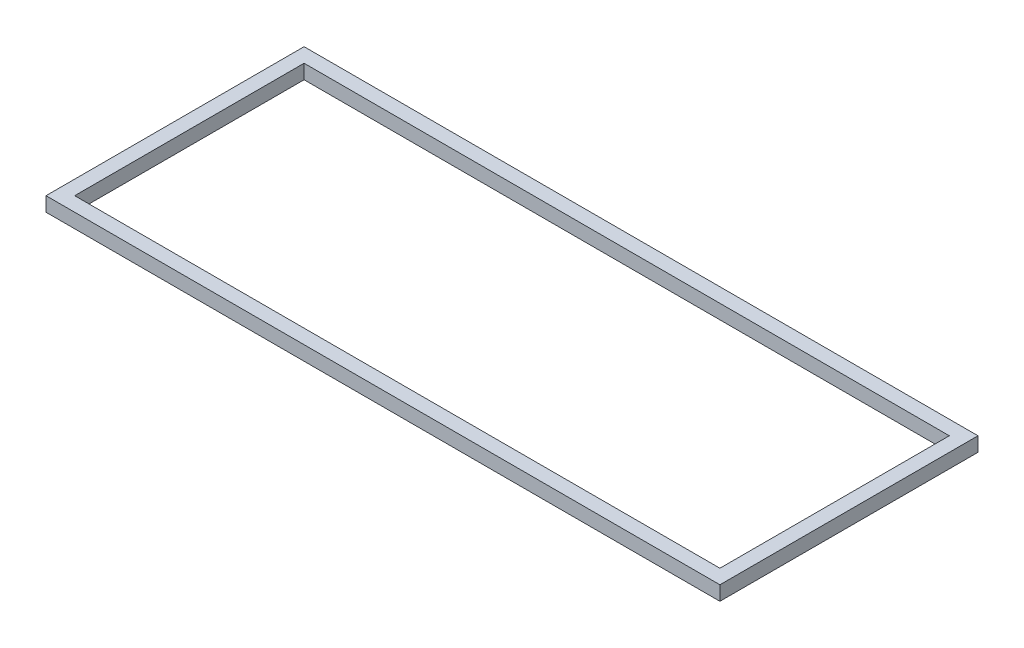
from build123d import *

# Parameters (mm, degrees)
SKETCH1_W           = 470
SKETCH1_H           = 180
SKETCH1_W_2         = 450
SKETCH1_H_2         = 160
BOSS_EXTRUDE1_DEPTH = 10


with BuildPart() as part:
    # Sketch1 → Boss-Extrude1 (new body)
    with BuildSketch(Plane(origin=(0, 0, 0), x_dir=(1, 0, 0), z_dir=(0, 1, 0))):
        with Locations((225, -80)):
            Rectangle(SKETCH1_W, SKETCH1_H)
        with Locations((225, -80)):
            Rectangle(SKETCH1_W_2, SKETCH1_H_2, mode=Mode.SUBTRACT)
    extrude(amount=BOSS_EXTRUDE1_DEPTH)


solid = part.part
